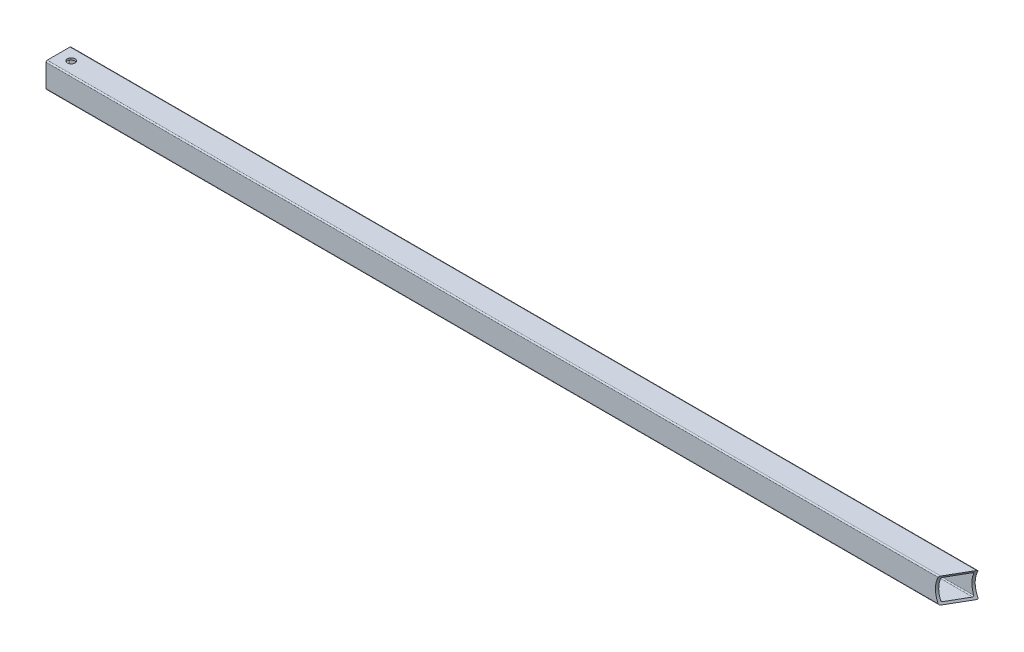
from build123d import *

# Parameters (mm, degrees)
BOSS_EXTRUDE1_DEPTH      = 457.2
BOSS_EXTRUDE1_DEPTH_BACK = 457.2
SKETCH5_R                = 3.81
CUT_EXTRUDE1_DEPTH       = 459.081095441
CUT_EXTRUDE2_DEPTH       = 459.081095441
CUT_EXTRUDE4_DEPTH       = 618.719010665
CUT_EXTRUDE4_DEPTH_BACK  = 618.719010665


with BuildPart() as part:
    # Sketch4 → Boss-Extrude1 (new, two sides: drawn at the far end of the back side and taken through both)
    with BuildSketch(Plane(origin=(0, 0, 0), x_dir=(0, 0, -1), z_dir=(1, 0, 0)).offset(-BOSS_EXTRUDE1_DEPTH_BACK)):
        with BuildLine():
            Line((12.7, -11.43), (12.7, 11.43))
            ThreePointArc((12.7, 11.43), (12.328025612, 12.328025612), (11.43, 12.7))
            Line((11.43, 12.7), (-11.43, 12.7))
            ThreePointArc((-11.43, 12.7), (-12.328025612, 12.328025612), (-12.7, 11.43))
            Line((-12.7, 11.43), (-12.7, -11.43))
            ThreePointArc((-12.7, -11.43), (-12.328025612, -12.328025612), (-11.43, -12.7))
            Line((-11.43, -12.7), (11.43, -12.7))
            ThreePointArc((11.43, -12.7), (12.328025612, -12.328025612), (12.7, -11.43))
        make_face()
        with BuildLine():
            Line((10.5918, 9.53262), (10.5918, -9.53262))
            ThreePointArc((10.5918, -9.53262), (10.28157336, -10.28157336), (9.53262, -10.5918))
            Line((9.53262, -10.5918), (-9.53262, -10.5918))
            ThreePointArc((-9.53262, -10.5918), (-10.28157336, -10.28157336), (-10.5918, -9.53262))
            Line((-10.5918, -9.53262), (-10.5918, 9.53262))
            ThreePointArc((-10.5918, 9.53262), (-10.28157336, 10.28157336), (-9.53262, 10.5918))
            Line((-9.53262, 10.5918), (9.53262, 10.5918))
            ThreePointArc((9.53262, 10.5918), (10.28157336, 10.28157336), (10.5918, 9.53262))
        make_face(mode=Mode.SUBTRACT)
    extrude(amount=BOSS_EXTRUDE1_DEPTH + BOSS_EXTRUDE1_DEPTH_BACK)

    # Sketch5 → Cut-Extrude1 (cut, through all)
    with BuildSketch(Plane(origin=(0, 12.7, 0), x_dir=(1, 0, 0), z_dir=(0, 1, 0))):
        with Locations(Location((-444.5, 0, 0), (0, 0, 270))):
            Circle(SKETCH5_R)
    extrude(amount=-CUT_EXTRUDE1_DEPTH, mode=Mode.SUBTRACT)

    # Sketch7 → Cut-Extrude2 (cut, through all)
    with BuildSketch(Plane(origin=(0, 12.7, 0), x_dir=(1, 0, 0), z_dir=(0, 1, 0))):
        Polygon((457.2, 12.7), (442.535303163, -12.7), (457.2, -12.7), align=None)
    extrude(amount=-CUT_EXTRUDE2_DEPTH, mode=Mode.SUBTRACT)

    # Sketch8 → Cut-Extrude4 (cut, two sides: drawn at the far end of the back side and taken through both)
    with BuildSketch(Plane(origin=(119.799261314, 0, -207.498407305), x_dir=(0, 1, 0), z_dir=(0.5000000000000046, 0, -0.866025403784436)).offset(-CUT_EXTRUDE4_DEPTH_BACK)):
        with BuildLine():
            Line((1441.154483305, 1098.308705448), (12.7, 389.59681461))
            ThreePointArc((12.7, 389.59681461), (0, 386.619482961), (-12.7, 389.59681461))
            Line((-12.7, 389.59681461), (-1441.154483305, 1098.308705448))
            Line((-1441.154483305, 1098.308705448), (-1441.154483305, 4287.512214218))
            Line((-1441.154483305, 4287.512214218), (1441.154483305, 4287.512214218))
            Line((1441.154483305, 4287.512214218), (1441.154483305, 1098.308705448))
        make_face()
    extrude(amount=CUT_EXTRUDE4_DEPTH + CUT_EXTRUDE4_DEPTH_BACK, mode=Mode.SUBTRACT)


solid = part.part
